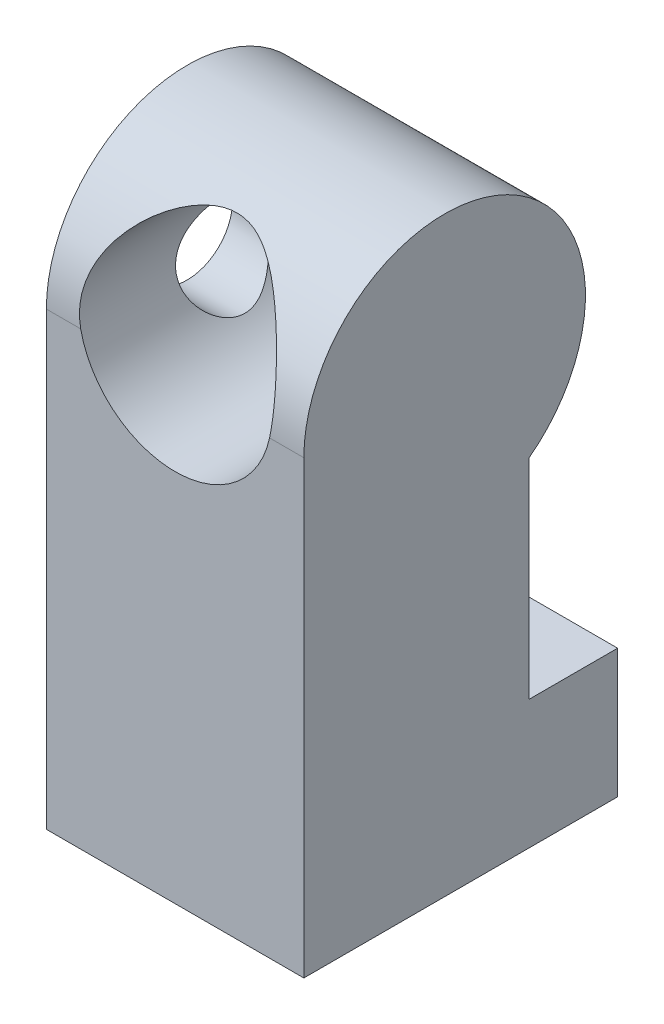
from build123d import *

# Parameters (mm, degrees)
BOSS_EXTRUDE1_DEPTH = 3.2
SKETCH2_W           = 4.8
SKETCH2_H           = 3.3
CUT_EXTRUDE1_DEPTH  = 8.9
SKETCH3_R           = 1.125
CUT_EXTRUDE2_DEPTH  = 2
SKETCH4_R           = 2.4
CUT_EXTRUDE3_DEPTH  = 5


with BuildPart() as part:
    # Sketch1 → Boss-Extrude1 (new, symmetric)
    with BuildSketch(Plane(origin=(0, 0, 0), x_dir=(0, 0, -1), z_dir=(1, 0, 0))):
        with BuildLine():
            Line((0, 0), (-7.8, 0))
            Line((-7.8, 0), (-7.8, 11.2))
            ThreePointArc((-7.8, 11.2), (-2.734752416, 14.330495168), (-2.2, 8.4))
            Line((-2.2, 8.4), (-2.2, 3.2))
            Line((-2.2, 3.2), (0, 3.2))
            Line((0, 3.2), (0, 0))
        make_face()
    extrude(amount=BOSS_EXTRUDE1_DEPTH, both=True)

    # Sketch2 → Cut-Extrude1 (cut)
    with BuildSketch(Plane.XZ):
        with Locations((0, 4.75)):
            Rectangle(SKETCH2_W, SKETCH2_H)
    extrude(amount=-CUT_EXTRUDE1_DEPTH, mode=Mode.SUBTRACT)

    # Sketch3 → Cut-Extrude2 (cut)
    with BuildSketch(Plane.ZY.offset(3.2)):
        with Locations((4.3, 11.2)):
            Circle(SKETCH3_R)
    extrude(amount=-CUT_EXTRUDE2_DEPTH, mode=Mode.SUBTRACT)

    # Sketch4 → Cut-Extrude3 (cut)
    with BuildSketch(Plane.XY.offset(7.8)):
        with Locations((0, 11.7)):
            Circle(SKETCH4_R)
    extrude(amount=-CUT_EXTRUDE3_DEPTH, mode=Mode.SUBTRACT)


solid = part.part
